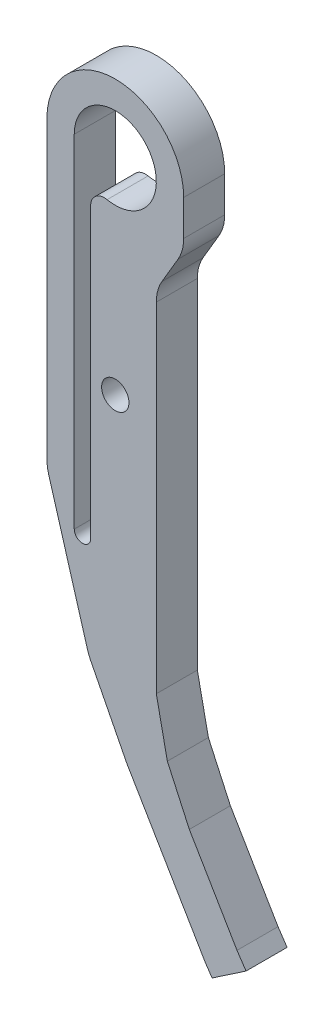
from build123d import *

# Parameters (mm, degrees)
SKETCH_1_R      = 1
EXTRUDE_1_DEPTH = 3


with BuildPart() as part:
    # 草图1 → 凸台-拉伸1 (new body)
    with BuildSketch(Plane.XY):
        with BuildLine():
            Line((5, 0), (5, -2.598546895))
            ThreePointArc((5, -2.598546895), (4.894337932, -3.387728708), (4.584794711, -4.121319466))
            Line((4.584794711, -4.121319466), (3.415205289, -6.106611695))
            ThreePointArc((3.415205289, -6.106611695), (3.105662068, -6.840202453), (3, -7.629384266))
            Line((3, -7.629384266), (3, -32.42729606))
            Line((3, -32.42729606), (3.807110108, -36.292324141))
            Line((3.807110108, -36.292324141), (5.41514713, -39.807586397))
            Line((5.41514713, -39.807586397), (8.899761864, -45.72298083))
            Line((8.899761864, -45.72298083), (9.562607856, -46.702581702))
            Line((9.562607856, -46.702581702), (7.077963413, -48.383813985))
            Line((7.077963413, -48.383813985), (6.565734565, -47.626805824))
            Line((6.565734565, -47.626805824), (0.880089764, -37.974998041))
            ThreePointArc((0.880089764, -37.974998041), (0.834425065, -37.894675513), (0.79125555, -37.812984837))
            Line((0.79125555, -37.812984837), (-1.794096527, -32.732789057))
            ThreePointArc((-1.794096527, -32.732789057), (-1.927277743, -32.438160812), (-2.032701862, -32.132499572))
            Line((-2.032701862, -32.132499572), (-4.857906932, -22.522211807))
            ThreePointArc((-4.857906932, -22.522211807), (-4.964294608, -22.033724953), (-5, -21.535063876))
            Line((-5, -21.535063876), (-5, 0))
            ThreePointArc((-5, 0), (0, 5), (5, 0))
        make_face()
        with Locations((0, -15)):
            Circle(SKETCH_1_R, mode=Mode.SUBTRACT)
        with BuildLine():
            Line((-3, -25), (-3, 0))
            ThreePointArc((-3, 0), (2.323790008, 1.897366596), (-0.6, -2.939387691))
            ThreePointArc((-0.6, -2.939387691), (-1.432455532, -3.144586919), (-1.8, -3.919183588))
            Line((-1.8, -3.919183588), (-1.8, -25))
            ThreePointArc((-1.8, -25), (-2.4, -25.6), (-3, -25))
        make_face(mode=Mode.SUBTRACT)
    extrude(amount=EXTRUDE_1_DEPTH)


solid = part.part
